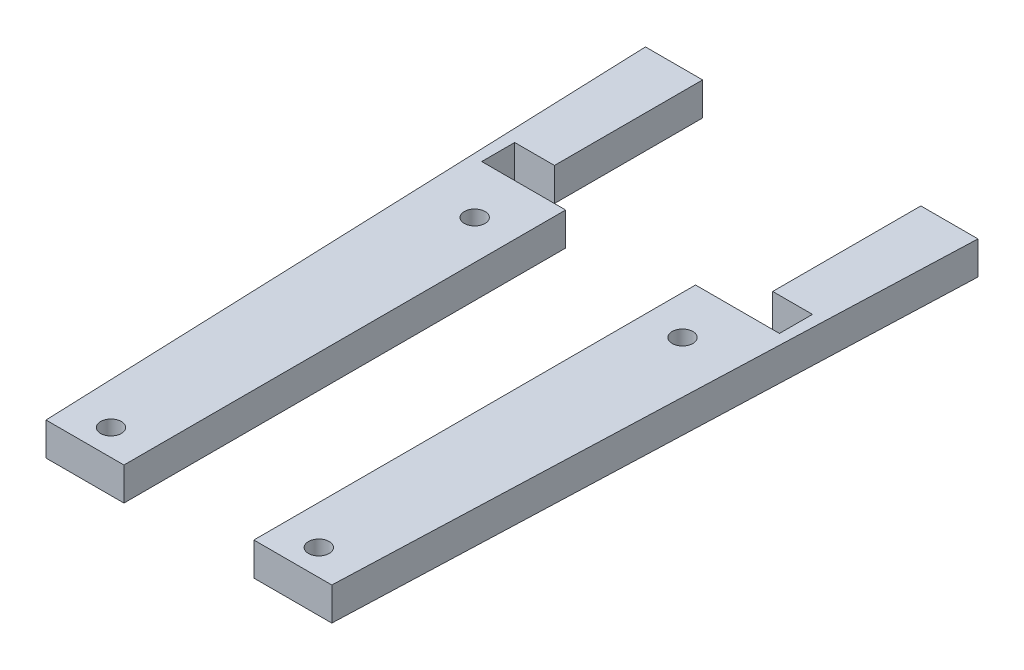
from build123d import *

# Parameters (mm, degrees)
BOSS_EXTRUDE1_DEPTH = 3.175
CUT_EXTRUDE1_DEPTH  = 204.000178571
SKETCH3_W           = 42
SKETCH3_H           = 55.35
SKETCH3_W_2         = 25
SKETCH3_H_2         = 85
SKETCH3_W_3         = 7.65
SKETCH3_H_3         = 6.35
CUT_EXTRUDE2_DEPTH  = 203.504166283
SKETCH4_R           = 2
CUT_EXTRUDE3_DEPTH  = 203.504166283


with BuildPart() as part:
    # Sketch1 → Boss-Extrude1 (new, symmetric)
    with BuildSketch(Plane(origin=(0, 0, 0), x_dir=(1, 0, 0), z_dir=(0, 1, 0))):
        with BuildLine():
            ThreePointArc((35, 0), (0, 35), (-35, 0))
            Line((-35, 0), (-27.5, -199.859325527))
            Line((-27.5, -199.859325527), (27.5, -199.859325527))
            Line((27.5, -199.859325527), (35, 0))
        make_face()
    extrude(amount=BOSS_EXTRUDE1_DEPTH, both=True)

    # Sketch2 → Cut-Extrude1 (cut, through all)
    with BuildSketch(Plane(origin=(0, 3.175, 0), x_dir=(1, 0, 0), z_dir=(0, 1, 0))):
        with BuildLine():
            Line((-31.997888398, -80), (31.997888398, -80))
            Line((31.997888398, -80), (35, 0))
            ThreePointArc((35, 0), (0, 35), (-35, 0))
            Line((-35, 0), (-31.997888398, -80))
        make_face()
    extrude(amount=-CUT_EXTRUDE1_DEPTH, mode=Mode.SUBTRACT)

    # Sketch3 → Cut-Extrude2 (cut, through all)
    with BuildSketch(Plane(origin=(0, 3.175, 0), x_dir=(1, 0, 0), z_dir=(0, 1, 0))):
        with Locations((0, -87.184325527)):
            Rectangle(SKETCH3_W, SKETCH3_H)
        with Locations((0, -157.359325527)):
            Rectangle(SKETCH3_W_2, SKETCH3_H_2)
        with Locations((-24.825, -111.684325527)):
            Rectangle(SKETCH3_W_3, SKETCH3_H_3)
        with Locations((24.825, -111.684325527)):
            Rectangle(SKETCH3_W_3, SKETCH3_H_3)
    extrude(amount=-CUT_EXTRUDE2_DEPTH, mode=Mode.SUBTRACT)


with BuildPart() as cut_extrude2_piece_1:
    # of the separate pieces the step leaves, piece 1, a body of its own (cut_extrude2_pieces)
    add(part.part.solids().sort_by_distance((-31.997888398, 3.175, 80))[0])


with BuildPart() as cut_extrude2_piece_2:
    # of the separate pieces the step leaves, piece 2, a body of its own (cut_extrude2_pieces)
    add(part.part.solids().sort_by_distance((21, 3.175, 80))[0])


with BuildPart() as cut_extrude3_tool:
    # Sketch4 → Cut-Extrude3 (new, through all)
    with BuildSketch(Plane(origin=(0, 3.175, 0), x_dir=(1, 0, 0), z_dir=(0, 1, 0))):
        with Locations(Location((20, -194.859325527, 0), (0, 0, 270))):
            Circle(SKETCH4_R)
        with Locations(Location((-20, -194.859325527, 0), (0, 0, 270))):
            Circle(SKETCH4_R)
        with Locations(Location((-20, -124.859325527, 0), (0, 0, 90))):
            Circle(SKETCH4_R)
        with Locations(Location((20, -124.859325527, 0), (0, 0, 90))):
            Circle(SKETCH4_R)
    extrude(amount=-CUT_EXTRUDE3_DEPTH)


with BuildPart() as cut_extrude2_piece_1_1:
    add(cut_extrude2_piece_1.part)

    # Cut-Extrude3: cut by cut_extrude3_tool
    add(cut_extrude3_tool.part, mode=Mode.SUBTRACT)


with BuildPart() as cut_extrude2_piece_2_1:
    add(cut_extrude2_piece_2.part)

    # Cut-Extrude3: cut by cut_extrude3_tool
    add(cut_extrude3_tool.part, mode=Mode.SUBTRACT)


solid = Compound([cut_extrude2_piece_1_1.part, cut_extrude2_piece_2_1.part])
